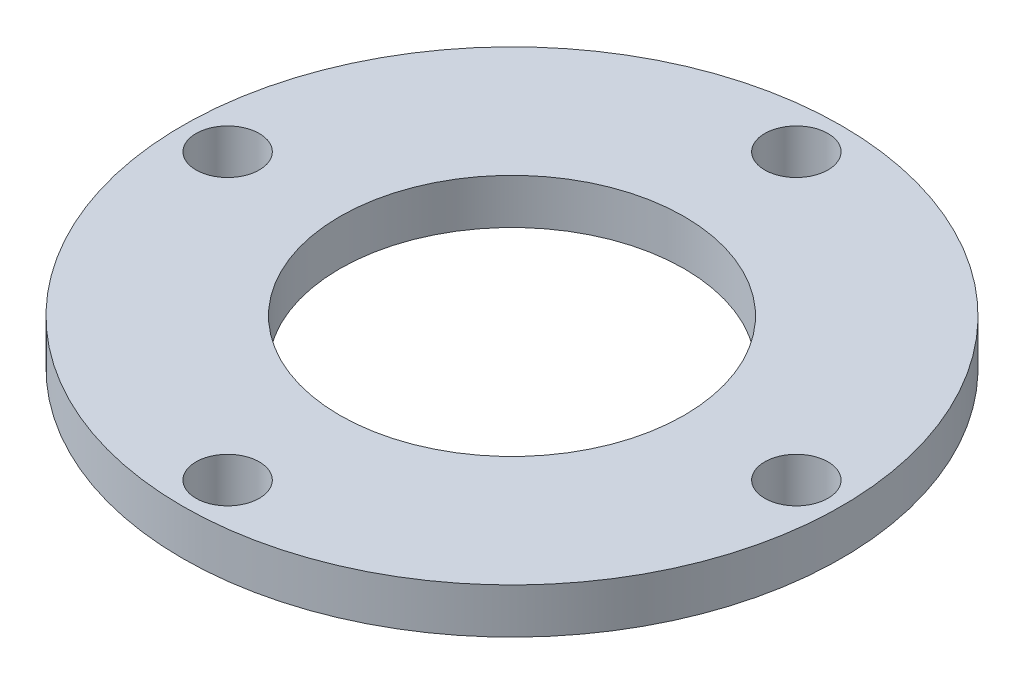
from build123d import *

# Parameters (mm, degrees)
SKETCH1_R           = 10.9375
SKETCH1_R_2         = 5.715
SKETCH1_R_3         = 1.05
BOSS_EXTRUDE1_DEPTH = 1.5


with BuildPart() as part:
    # Sketch1 → Boss-Extrude1 (new body)
    with BuildSketch(Plane(origin=(0, 0, 0), x_dir=(1, 0, 0), z_dir=(0, 1, 0))):
        with Locations(Location((0, 0, 0), (0, 0, 270))):
            Circle(SKETCH1_R)
        with Locations(Location((0, 0, 0), (0, 0, 270))):
            Circle(SKETCH1_R_2, mode=Mode.SUBTRACT)
        with Locations(Location((0, 9.4375, 0), (0, 0, 270))):
            Circle(SKETCH1_R_3, mode=Mode.SUBTRACT)
        with Locations(Location((9.4375, 0, 0), (0, 0, 270))):
            Circle(SKETCH1_R_3, mode=Mode.SUBTRACT)
        with Locations(Location((0, -9.4375, 0), (0, 0, 270))):
            Circle(SKETCH1_R_3, mode=Mode.SUBTRACT)
        with Locations(Location((-9.4375, 0, 0), (0, 0, 270))):
            Circle(SKETCH1_R_3, mode=Mode.SUBTRACT)
    extrude(amount=BOSS_EXTRUDE1_DEPTH)


solid = part.part
